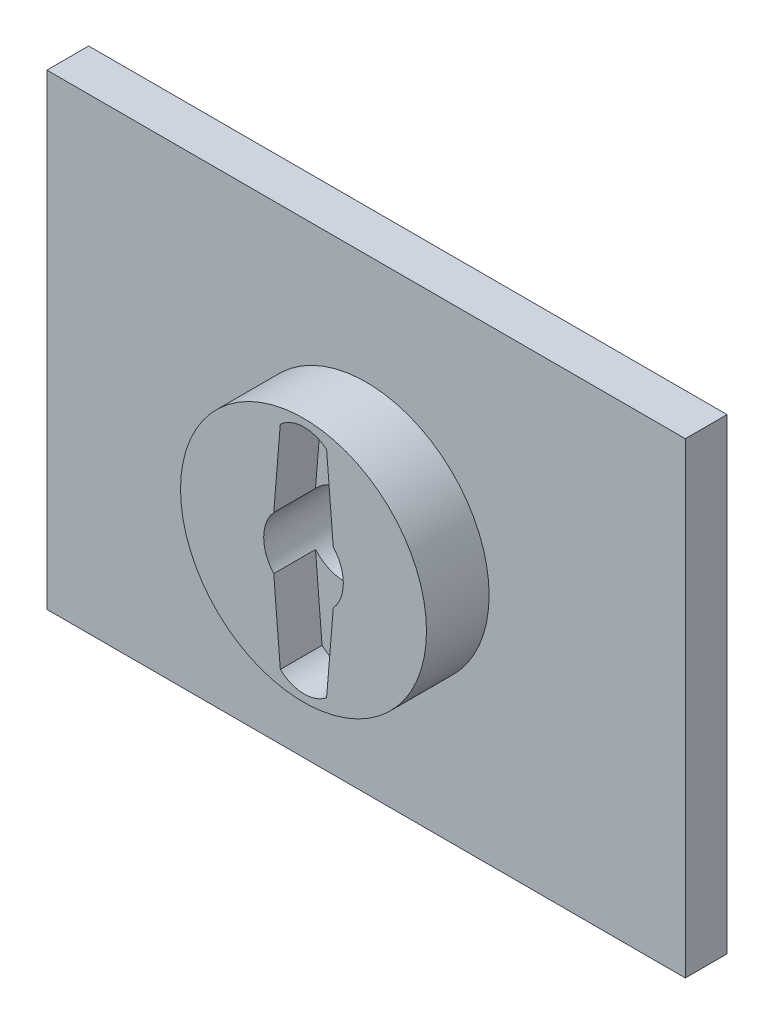
from build123d import *

# Parameters (mm, degrees)
ESQUISSE1_W             = 61.168999858
ESQUISSE1_H             = 44.751998484
ESQUISSE1_R             = 3.815511502
BOSS_EXTRU_2_DEPTH      = 4
BOSS_EXTRU_4_START      = 4
ESQUISSE2_R             = 11.783463465
BOSS_EXTRU_4_DEPTH      = 6
ENL_V_MAT_EXTRU_1_DEPTH = 4
ESQUISSE1_2_R           = 3.815511502
ENL_V_MAT_EXTRU_3_DEPTH = 40.193073087


with BuildPart() as part:
    # Esquisse1 → Boss.-Extru.2 (new body)
    with BuildSketch(Plane.XY):
        Rectangle(ESQUISSE1_W, ESQUISSE1_H)
        Circle(ESQUISSE1_R, mode=Mode.SUBTRACT)
    extrude(amount=BOSS_EXTRU_2_DEPTH)

    # Esquisse2 → Boss.-Extru.4 (add)
    with BuildSketch(Plane.XY.offset(BOSS_EXTRU_4_START)):
        Circle(ESQUISSE2_R)
    extrude(amount=BOSS_EXTRU_4_DEPTH)

    # Esquisse4 → Enlèv. mat.-Extru.1 (cut)
    with BuildSketch(Plane.XY.offset(10)):
        with BuildLine():
            Line((2.87019869, 2.302904251), (2.212319523, 10.306766943))
            ThreePointArc((2.212319523, 10.306766943), (-0.029730087, 11.070975118), (-2.223029733, 10.17641531))
            Line((-2.223029733, 10.17641531), (-2.870198645, 2.302904307))
            ThreePointArc((-2.870198645, 2.302904307), (-3.679865285, 0), (-2.870198645, -2.302904307))
            Line((-2.870198645, -2.302904307), (-2.223029733, -10.17641531))
            ThreePointArc((-2.223029733, -10.17641531), (-0.029730087, -11.070975118), (2.212319523, -10.306766943))
            Line((2.212319523, -10.306766943), (2.87019869, -2.302904251))
            ThreePointArc((2.87019869, -2.302904251), (3.679865285, 0), (2.87019869, 2.302904251))
        make_face()
    extrude(amount=-ENL_V_MAT_EXTRU_1_DEPTH, mode=Mode.SUBTRACT)

    # Esquisse1<2> → Enlèv. mat.-Extru.3 (cut, through all)
    with BuildSketch(Plane.XY):
        Circle(ESQUISSE1_2_R)
    extrude(amount=ENL_V_MAT_EXTRU_3_DEPTH, mode=Mode.SUBTRACT)


solid = part.part
